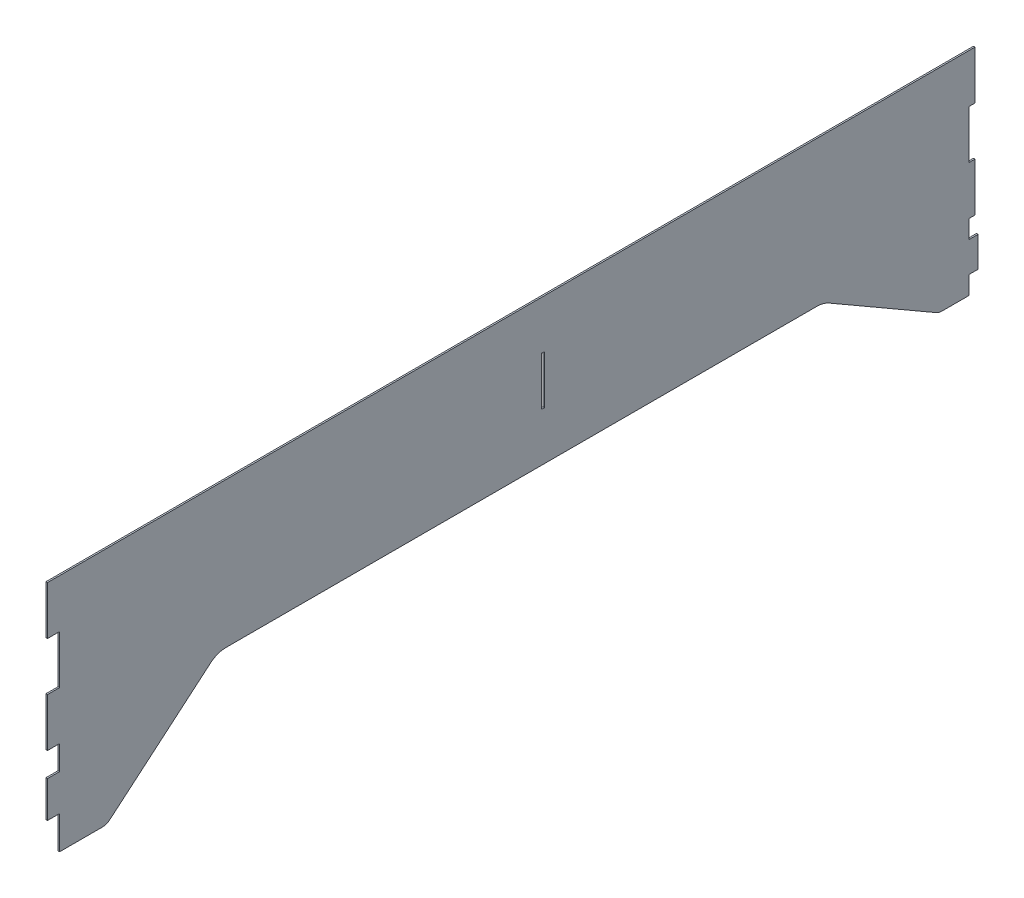
from build123d import *

# Parameters (mm, degrees)
SKETCH1_W           = 25.4
SKETCH1_H           = 1.5875
BOSS_EXTRUDE1_DEPTH = 0.79375


with BuildPart() as part:
    # Sketch1 → Boss-Extrude1 (new body)
    # profile 1 of 3: a face of its own
    with BuildSketch(Plane(origin=(-94.488, 0, 0), x_dir=(0, -1, 0), z_dir=(-1, 0, 0))):
        Polygon((136.525, -196.85), (111.125, -196.85), (111.125, -203.2), (85.725, -203.2), (85.725, -196.85), (60.325, -196.85), (60.325, -682.625), (85.725, -682.625), (85.725, -679.45), (111.125, -679.45), (111.125, -682.625), (136.525, -682.625), align=None)
        with Locations((98.425, -456.40625)):
            Rectangle(SKETCH1_W, SKETCH1_H, mode=Mode.SUBTRACT)
    # profile 2 of 3: a face of its own
    with BuildSketch(Plane(origin=(-94.488, 0, 0), x_dir=(0, -1, 0), z_dir=(-1, 0, 0))):
        with BuildLine():
            Line((149.225, -203.2), (136.525, -203.2))
            Line((136.525, -203.2), (136.525, -290.406498707))
            ThreePointArc((136.525, -290.406498707), (137.30121982, -286.034603668), (139.534994681, -282.197126202))
            Line((139.534994681, -282.197126202), (184.118202659, -229.57294303))
            ThreePointArc((184.118202659, -229.57294303), (185.23509009, -227.654204297), (185.6232, -225.468256778))
            Line((185.6232, -225.468256778), (185.6232, -203.2))
            Line((185.6232, -203.2), (168.275, -203.2))
            Line((168.275, -203.2), (168.275, -196.85))
            Line((168.275, -196.85), (149.225, -196.85))
            Line((149.225, -196.85), (149.225, -203.2))
        make_face()
    # profile 3 of 3: a face of its own
    with BuildSketch(Plane(origin=(-94.488, 0, 0), x_dir=(0, -1, 0), z_dir=(-1, 0, 0))):
        with BuildLine():
            ThreePointArc((138.226477372, -606.197045256), (136.957742006, -603.134047129), (136.525, -599.847045256))
            Line((136.525, -599.847045256), (136.525, -679.45))
            Line((136.525, -679.45), (146.05, -679.45))
            Line((146.05, -679.45), (146.05, -684.2125))
            Line((146.05, -684.2125), (161.925, -684.2125))
            Line((161.925, -684.2125), (161.925, -679.45))
            Line((161.925, -679.45), (171.45, -679.45))
            Line((171.45, -679.45), (171.45, -665.443351826))
            ThreePointArc((171.45, -665.443351826), (171.233628997, -663.79985089), (170.599261314, -662.268351826))
            Line((170.599261314, -662.268351826), (138.226477372, -606.197045256))
        make_face()
    extrude(amount=-BOSS_EXTRUDE1_DEPTH)


solid = part.part
